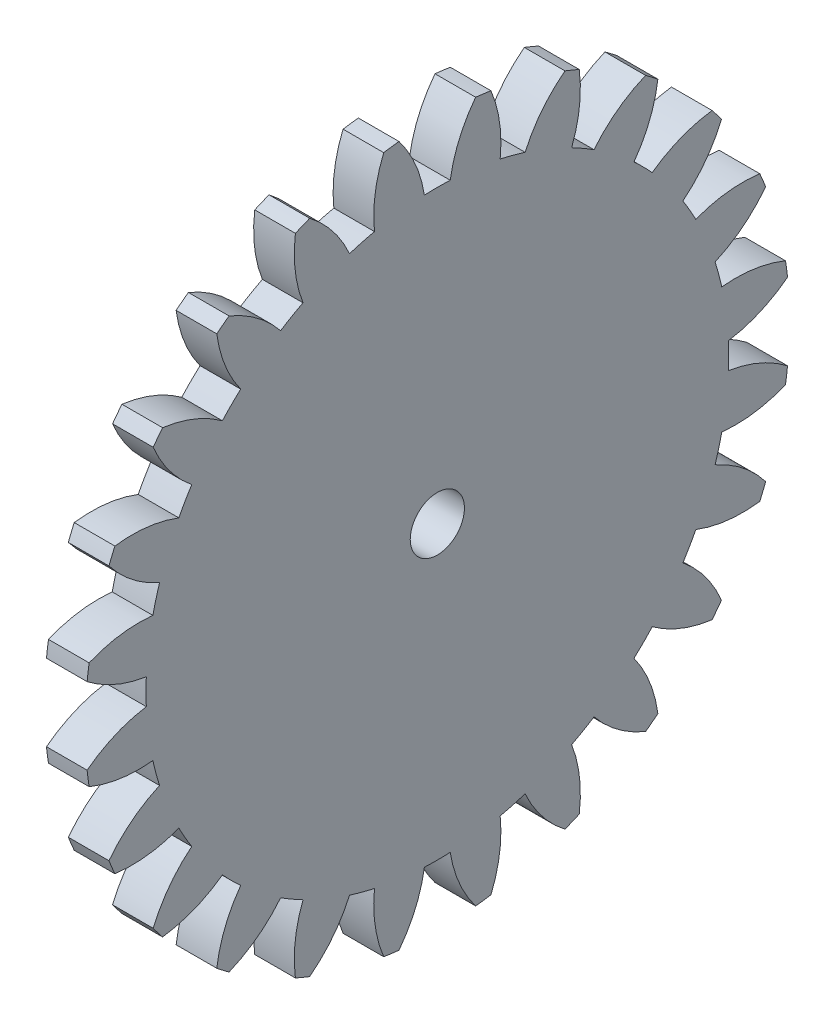
from build123d import *

# Parameters (mm, degrees)
BASPROSKE_W     = 3
BASPROSKE_H     = 26
TOOTHCUT_DEPTH  = 37.891733491
TEETHCUTS_COUNT = 24
TEETHCUTS_ANGLE = 345
BORSKE_R        = 2
BORE_DEPTH      = 50.0000508


with BuildPart() as part:
    # BasProSke → Base-Revolve (revolve)
    with BuildSketch(Plane(origin=(0, 0, 0), x_dir=(1, 0, 0), z_dir=(0, 1, 0)), mode=Mode.PRIVATE) as base_revolve_sk:
        with Locations((1.5, 13)):
            Rectangle(BASPROSKE_W, BASPROSKE_H)
    revolve(base_revolve_sk.sketch.rotate(Axis((-10, 0, 0), (1, 0, 0)), 180), axis=Axis((-10, 0, 0), (1, 0, 0)))

    # TooCutSke → ToothCut (cut, through all)
    with BuildSketch(Plane(origin=(0, 0, 0), x_dir=(0, 0, -1), z_dir=(1, 0, 0))):
        with BuildLine():
            ThreePointArc((0.952932849, 21.477870471), (0, 21.499), (-0.952932849, 21.477870471))
            ThreePointArc((-0.952932849, 21.477870471), (-1.621910648, 23.79336664), (-2.846540061, 25.86926081))
            ThreePointArc((-2.846540061, 25.86926081), (0, 26.0254), (2.846540061, 25.86926081))
            ThreePointArc((2.846540061, 25.86926081), (1.621910648, 23.79336664), (0.952932849, 21.477870471))
        make_face()
    toothcut = extrude(amount=TOOTHCUT_DEPTH, mode=Mode.SUBTRACT)

    # TeethCuts: ToothCut ×24 about axis
    teethcuts_axis = Axis((-10, 0, 0), (1, 0, 0))
    for i in range(1, TEETHCUTS_COUNT):
        add(toothcut.rotate(teethcuts_axis, i * TEETHCUTS_ANGLE / (TEETHCUTS_COUNT - 1)), mode=Mode.SUBTRACT)

    # BorSke → Bore (cut, symmetric)
    with BuildSketch(Plane(origin=(0, 0, 0), x_dir=(0, 0, -1), z_dir=(1, 0, 0))):
        with Locations(Location((0, 0, 0), (0, 0, 180))):
            Circle(BORSKE_R)
    extrude(amount=BORE_DEPTH, both=True, mode=Mode.SUBTRACT)


solid = part.part
